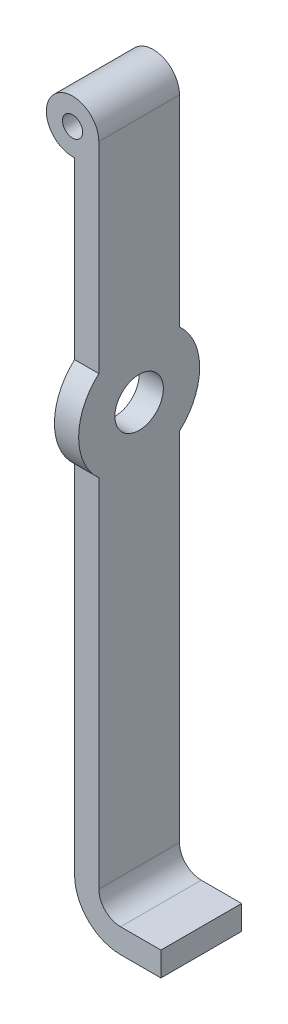
from build123d import *

# Parameters (mm, degrees)
SKETCH1_R           = 1.25
BOSS_EXTRUDE1_DEPTH = 10
CUT_EXTRUDE1_REACH  = 89.179
SKETCH2_R           = 3
SKETCH3_R           = 7.5
SKETCH3_R_2         = 3
BOSS_EXTRUDE2_DEPTH = 3


with BuildPart() as part:
    # Sketch1 → Boss-Extrude1 (new body)
    with BuildSketch(Plane.XY):
        with BuildLine():
            Line((0.25, -3.240370349), (0.25, -80.240370349))
            ThreePointArc((0.25, -80.240370349), (1.919491347, -84.270879002), (5.95, -85.940370349))
            Line((5.95, -85.940370349), (10.95, -85.940370349))
            Line((10.95, -85.940370349), (10.95, -82.940370349))
            Line((10.95, -82.940370349), (5.95, -82.940370349))
            ThreePointArc((5.95, -82.940370349), (4.040811691, -82.149558658), (3.25, -80.240370349))
            Line((3.25, -80.240370349), (3.25, 0))
            ThreePointArc((3.25, 0), (-2.384848004, 2.207940217), (0.25, -3.240370349))
        make_face()
        Circle(SKETCH1_R, mode=Mode.SUBTRACT)
    extrude(amount=BOSS_EXTRUDE1_DEPTH)

    # Sketch2 → Cut-Extrude1 (cut, up to next)
    with BuildSketch(Plane.ZY.offset(-0.25), mode=Mode.PRIVATE) as cut_extrude1_sk1:
        with Locations(Location((5, -30.5, 0), (0, 0, 270))):
            Circle(SKETCH2_R)
    cut_extrude1_tool1 = extrude(cut_extrude1_sk1.sketch, amount=-CUT_EXTRUDE1_REACH, mode=Mode.PRIVATE) & part.part
    add(cut_extrude1_tool1.solids().sort_by_distance((0.25, -30.5, 5))[0], mode=Mode.SUBTRACT)

    # Sketch3 → Boss-Extrude2 (add)
    with BuildSketch(Plane.ZY.offset(-0.25)):
        with Locations((5, -30.5)):
            Circle(SKETCH3_R)
        with Locations(Location((5, -30.5, 0), (0, 0, 270))):
            Circle(SKETCH3_R_2, mode=Mode.SUBTRACT)
    extrude(amount=-BOSS_EXTRUDE2_DEPTH)


solid = part.part
